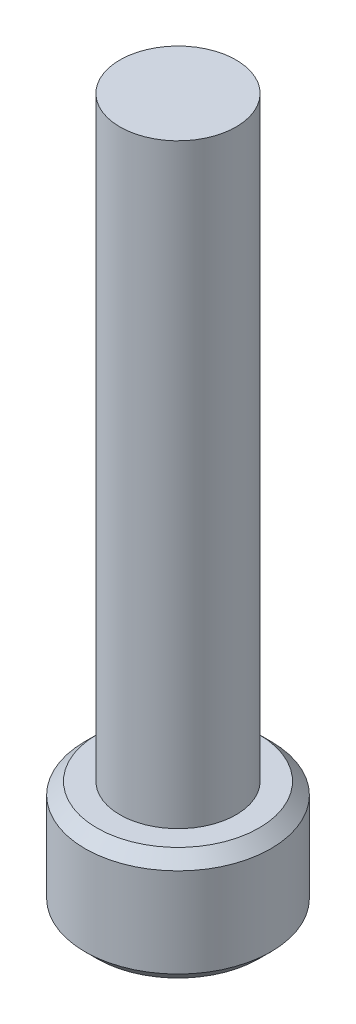
from build123d import *

# Parameters (mm, degrees)
SKETCH1_R           = 2.4765
BOSS_EXTRUDE1_DEPTH = 25.4
SKETCH2_R           = 3.9624
BOSS_EXTRUDE2_DEPTH = 4.826
CUT_EXTRUDE1_DEPTH  = 2.286
CHAMFER1_SIZE       = 0.508


with BuildPart() as part:
    # Sketch1 → Boss-Extrude1 (new body)
    with BuildSketch(Plane(origin=(0, 0, 0), x_dir=(1, 0, 0), z_dir=(0, 1, 0))):
        with Locations(Location((0, 0, 0), (0, 0, 270))):
            Circle(SKETCH1_R)
    extrude(amount=BOSS_EXTRUDE1_DEPTH)

    # Sketch2 → Boss-Extrude2 (add)
    with BuildSketch(Plane.XZ):
        with Locations(Location((0, 0, 0), (0, 0, 270))):
            Circle(SKETCH2_R)
    extrude(amount=BOSS_EXTRUDE2_DEPTH)

    # Sketch3 → Cut-Extrude1 (cut)
    with BuildSketch(Plane.XZ.offset(4.826)):
        Polygon((2.291358881, 0), (1.14567944, 1.984375), (-1.14567944, 1.984375), (-2.291358881, 0), (-1.14567944, -1.984375), (1.14567944, -1.984375), align=None)
    extrude(amount=-CUT_EXTRUDE1_DEPTH, mode=Mode.SUBTRACT)

    # Chamfer1
    chamfer1_edges = [part.edges().sort_by_distance(p)[0] for p in [
        (0, 0, 3.9624),
        (0, -4.826, 3.9624),
    ]]
    chamfer(chamfer1_edges, length=CHAMFER1_SIZE)


solid = part.part
